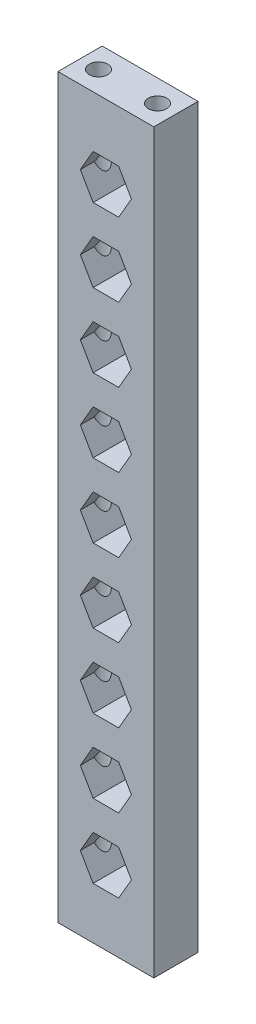
from build123d import *

# Parameters (mm, degrees)
SKETCH_1_W                   = 13
SKETCH_1_H                   = 6
EXTRUDE_1_DEPTH              = 100
CUT_EXTRUDE_1_DEPTH          = 101.390487597
CUT_EXTRUDE_1_DEPTH_BACK     = 101.390487597
HOLE_WIZARD_M3_1_D           = 2.5
HOLE_WIZARD_M3_1_CSINK_D     = 3.05
HOLE_WIZARD_M3_1_CSINK_ANGLE = 90


with BuildPart() as part:
    # 草图1 → 凸台-拉伸1 (new body)
    with BuildSketch(Plane(origin=(0, 0, 0), x_dir=(1, 0, 0), z_dir=(0, 1, 0))):
        Rectangle(SKETCH_1_W, SKETCH_1_H)
    extrude(amount=EXTRUDE_1_DEPTH)

    # 草图2 → 切除-拉伸1 (cut, two sides: drawn at the far end of the back side and taken through both)
    with BuildSketch(Plane(origin=(0, 0, -3), x_dir=(-1, 0, 0), z_dir=(0, 0, -1)).offset(-CUT_EXTRUDE_1_DEPTH_BACK)):
        Polygon((-1.732050808, 13), (-3.464101615, 10), (-1.732050808, 7), (1.732050808, 7), (3.464101615, 10), (1.732050808, 13), align=None)
        Polygon((-1.732050808, 23), (-3.464101615, 20), (-1.732050808, 17), (1.732050808, 17), (3.464101615, 20), (1.732050808, 23), align=None)
        Polygon((-1.732050808, 33), (-3.464101615, 30), (-1.732050808, 27), (1.732050808, 27), (3.464101615, 30), (1.732050808, 33), align=None)
        Polygon((-1.732050808, 43), (-3.464101615, 40), (-1.732050808, 37), (1.732050808, 37), (3.464101615, 40), (1.732050808, 43), align=None)
        Polygon((-1.732050808, 53), (-3.464101615, 50), (-1.732050808, 47), (1.732050808, 47), (3.464101615, 50), (1.732050808, 53), align=None)
        Polygon((-1.732050808, 63), (-3.464101615, 60), (-1.732050808, 57), (1.732050808, 57), (3.464101615, 60), (1.732050808, 63), align=None)
        Polygon((-1.732050808, 73), (-3.464101615, 70), (-1.732050808, 67), (1.732050808, 67), (3.464101615, 70), (1.732050808, 73), align=None)
        Polygon((-1.732050808, 83), (-3.464101615, 80), (-1.732050808, 77), (1.732050808, 77), (3.464101615, 80), (1.732050808, 83), align=None)
        Polygon((-1.732050808, 93), (-3.464101615, 90), (-1.732050808, 87), (1.732050808, 87), (3.464101615, 90), (1.732050808, 93), align=None)
    extrude(amount=CUT_EXTRUDE_1_DEPTH + CUT_EXTRUDE_1_DEPTH_BACK, mode=Mode.SUBTRACT)

    # M3 螺纹孔1 (through all)
    with Locations(Plane(origin=(0, 0, 0), x_dir=(-1, 0, 0), z_dir=(0, -1, 0))):
        with Locations((4, 0), (-4, 0)):
            CounterSinkHole(HOLE_WIZARD_M3_1_D / 2, HOLE_WIZARD_M3_1_CSINK_D / 2, counter_sink_angle=HOLE_WIZARD_M3_1_CSINK_ANGLE)


solid = part.part
